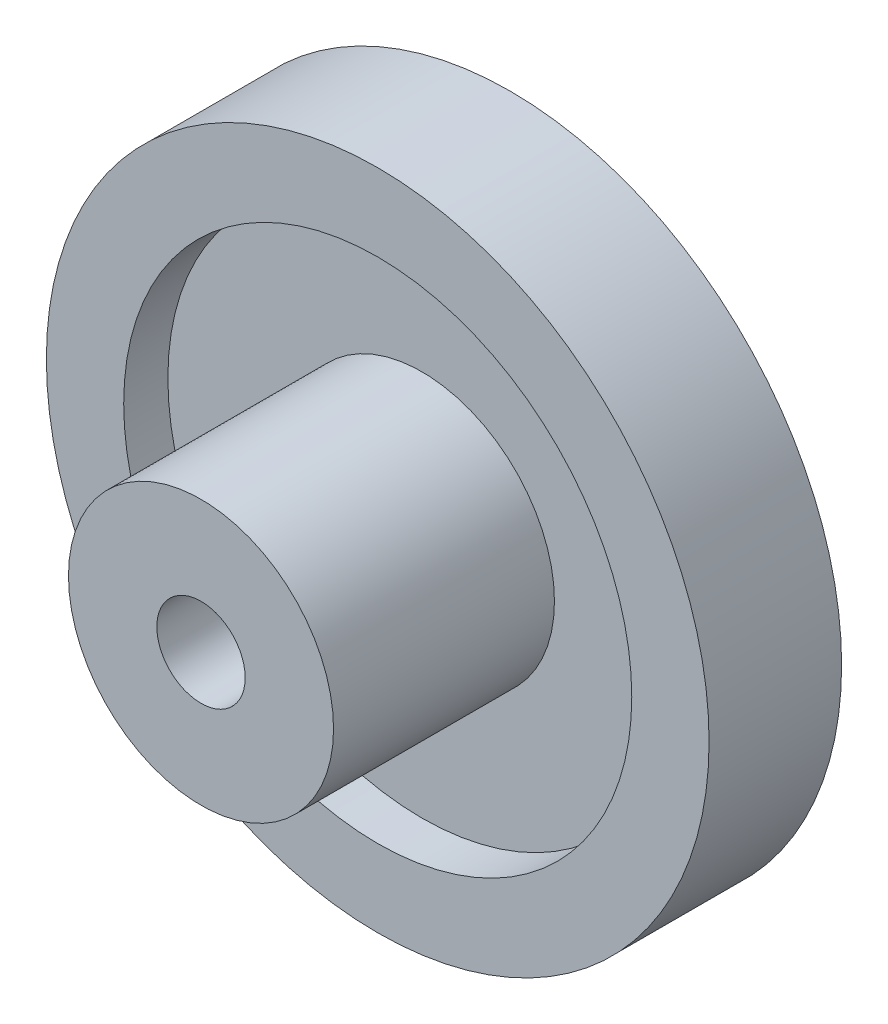
from build123d import *

# Parameters (mm, degrees)
ESQUISSE1_R             = 1
BOSS_EXTRU_1_DEPTH      = 3
ESQUISSE2_R             = 5.75
ENL_V_MAT_EXTRU_1_DEPTH = 1
ESQUISSE3_R             = 1
BOSS_EXTRU_2_DEPTH      = 5
BOSS_EXTRU_3_START      = -3
ESQUISSE4_R             = 7.5
ESQUISSE4_R_2           = 5.75
BOSS_EXTRU_3_DEPTH      = 3
BOSS_EXTRU_4_START      = -5
ESQUISSE5_R             = 3
ESQUISSE5_R_2           = 1
BOSS_EXTRU_4_DEPTH      = 5


with BuildPart() as part:
    # Esquisse1 → Boss.-Extru.1 (new body)
    with BuildSketch(Plane.XY):
        with BuildLine():
            ThreePointArc((7.491868518, 0.349150543), (7.48109955, 0.532117964), (7.465862795, 0.714767599))
            add(Edge.make_bspline(
                [(6.511775734, 0.931053619), (6.54533459, 0.935851864), (6.691230758, 0.932883331), (6.92755526, 0.897904294), (7.210754579, 0.816287714), (7.382633754, 0.750372838), (7.465862795, 0.714767599)],
                knots=[0, 0, 0, 0, 0.101700454, 0.434977009, 0.714423103, 0.984887496, 0.984887496, 0.984887496, 0.984887496], degree=3))
            ThreePointArc((6.511775734, 0.931053619), (6.361956751, 0.966352964), (6.279971624, 1.096622724))
            ThreePointArc((6.279971624, 1.096622724), (6.268309408, 1.161431083), (6.255978398, 1.226115524))
            ThreePointArc((6.255978398, 1.226115524), (6.285849036, 1.377110609), (6.413075806, 1.463742704))
            add(Edge.make_bspline(
                [(6.413075806, 1.463742704), (6.44612601, 1.471286197), (6.581273617, 1.526328257), (6.789378175, 1.643653855), (7.024536913, 1.821315017), (7.161390753, 1.944433854), (7.226338428, 2.00749419)],
                knots=[0, 0, 0, 0, 0.101700454, 0.434977009, 0.714423103, 0.984887496, 0.984887496, 0.984887496, 0.984887496], degree=3))
            ThreePointArc((7.226338428, 2.00749419), (7.175125379, 2.183477914), (7.119627274, 2.358157645))
            add(Edge.make_bspline(
                [(6.141333, 2.356716579), (6.172982756, 2.36886207), (6.315881563, 2.398432916), (6.554064484, 2.416918025), (6.848324803, 2.40036552), (7.030562047, 2.374349982), (7.119627274, 2.358157645)],
                knots=[0, 0, 0, 0, 0.101700454, 0.434977009, 0.714423103, 0.984887496, 0.984887496, 0.984887496, 0.984887496], degree=3))
            ThreePointArc((6.141333, 2.356716579), (5.987415449, 2.357793036), (5.878498112, 2.466553254))
            ThreePointArc((5.878498112, 2.466553254), (5.852707075, 2.527141645), (5.826291587, 2.587460404))
            ThreePointArc((5.826291587, 2.587460404), (5.821813738, 2.741316569), (5.926573213, 2.854087236))
            add(Edge.make_bspline(
                [(5.926573213, 2.854087236), (5.957116194, 2.86879596), (6.076627358, 2.952531173), (6.253406899, 3.113222794), (6.443136388, 3.338757362), (6.549162498, 3.489242196), (6.598449554, 3.565173695)],
                knots=[0, 0, 0, 0, 0.101700454, 0.434977009, 0.714423103, 0.984887496, 0.984887496, 0.984887496, 0.984887496], degree=3))
            ThreePointArc((6.598449554, 3.565173695), (6.50936046, 3.725349165), (6.416383912, 3.88329982))
            add(Edge.make_bspline(
                [(5.462938185, 3.664203929), (5.49109179, 3.683087641), (5.623827693, 3.743715059), (5.851925548, 3.814737394), (6.142491424, 3.864078976), (6.325948603, 3.879267303), (6.416383912, 3.88329982)],
                knots=[0, 0, 0, 0, 0.101700454, 0.434977009, 0.714423103, 0.984887496, 0.984887496, 0.984887496, 0.984887496], degree=3))
            ThreePointArc((5.462938185, 3.664203929), (5.312640134, 3.631003519), (5.182252157, 3.712800504))
            ThreePointArc((5.182252157, 3.712800504), (5.14362557, 3.766130772), (5.104450187, 3.819059215))
            ThreePointArc((5.104450187, 3.819059215), (5.06584839, 3.96806147), (5.142887492, 4.101315917))
            add(Edge.make_bspline(
                [(5.142887492, 4.101315917), (5.169391697, 4.122452315), (5.267273629, 4.230681847), (5.403863688, 4.426681742), (5.5386501, 4.688780471), (5.608531889, 4.859085365), (5.639686867, 4.944080505)],
                knots=[0, 0, 0, 0, 0.101700454, 0.434977009, 0.714423103, 0.984887496, 0.984887496, 0.984887496, 0.984887496], degree=3))
            ThreePointArc((5.639686867, 4.944080505), (5.517189028, 5.080415852), (5.391396269, 5.213717126))
            add(Edge.make_bspline(
                [(4.510608839, 4.787952794), (4.533854553, 4.812627817), (4.64977162, 4.901271697), (4.856346629, 5.021269902), (5.128647877, 5.134031378), (5.30412568, 5.189661964), (5.391396269, 5.213717126)],
                knots=[0, 0, 0, 0, 0.101700454, 0.434977009, 0.714423103, 0.984887496, 0.984887496, 0.984887496, 0.984887496], degree=3))
            ThreePointArc((4.510608839, 4.787952794), (4.37146686, 4.722140325), (4.22614644, 4.772872434))
            ThreePointArc((4.22614644, 4.772872434), (4.176621201, 4.816270376), (4.12665034, 4.85915445))
            ThreePointArc((4.12665034, 4.85915445), (4.05586025, 4.995831199), (4.101315917, 5.142887492))
            add(Edge.make_bspline(
                [(4.101315917, 5.142887492), (4.122452315, 5.169391697), (4.193796806, 5.296688467), (4.283348187, 5.518168384), (4.356432769, 5.803688548), (4.386666071, 5.985273704), (4.398126732, 6.075070473)],
                knots=[0, 0, 0, 0, 0.101700454, 0.434977009, 0.714423103, 0.984887496, 0.984887496, 0.984887496, 0.984887496], degree=3))
            ThreePointArc((4.398126732, 6.075070473), (4.248362699, 6.180729275), (4.096061504, 6.282696886))
            add(Edge.make_bspline(
                [(3.332098731, 5.671613712), (3.349270916, 5.700842739), (3.442556582, 5.813058106), (3.617250211, 5.976014969), (3.85763251, 6.146542008), (4.016331748, 6.239825304), (4.096061504, 6.282696886)],
                knots=[0, 0, 0, 0, 0.101700454, 0.434977009, 0.714423103, 0.984887496, 0.984887496, 0.984887496, 0.984887496], degree=3))
            ThreePointArc((3.332098731, 5.671613712), (3.211089984, 5.576489296), (3.058124094, 5.59361261))
            ThreePointArc((3.058124094, 5.59361261), (3.000183606, 5.624902073), (2.941923014, 5.655591391))
            ThreePointArc((2.941923014, 5.655591391), (2.842494341, 5.773089092), (2.854087236, 5.926573213))
            add(Edge.make_bspline(
                [(2.854087236, 5.926573213), (2.86879596, 5.957116194), (2.9100255, 6.097097011), (2.948047723, 6.33295102), (2.955765708, 6.627575448), (2.9448345, 6.811335427), (2.936026156, 6.901431041)],
                knots=[0, 0, 0, 0, 0.101700454, 0.434977009, 0.714423103, 0.984887496, 0.984887496, 0.984887496, 0.984887496], degree=3))
            ThreePointArc((2.936026156, 6.901431041), (2.766505726, 6.971115124), (2.595333111, 7.036635989))
            add(Edge.make_bspline(
                [(1.986503278, 6.270876237), (1.996740851, 6.303193602), (2.062717382, 6.433353509), (2.196769764, 6.631097693), (2.393179341, 6.850839356), (2.527142172, 6.977097748), (2.595333111, 7.036635989)],
                knots=[0, 0, 0, 0, 0.101700454, 0.434977009, 0.714423103, 0.984887496, 0.984887496, 0.984887496, 0.984887496], degree=3))
            ThreePointArc((1.986503278, 6.270876237), (1.889695647, 6.151209809), (1.736754636, 6.133865693))
            ThreePointArc((1.736754636, 6.133865693), (1.673304276, 6.151477692), (1.609675384, 6.168433363))
            ThreePointArc((1.609675384, 6.168433363), (1.486593897, 6.26086019), (1.463742704, 6.413075806))
            add(Edge.make_bspline(
                [(1.463742704, 6.413075806), (1.471286197, 6.44612601), (1.480333363, 6.591771651), (1.464919836, 6.830173049), (1.406884212, 7.11912804), (1.35533663, 7.295848351), (1.32670097, 7.381725038)],
                knots=[0, 0, 0, 0, 0.101700454, 0.434977009, 0.714423103, 0.984887496, 0.984887496, 0.984887496, 0.984887496], degree=3))
            ThreePointArc((1.32670097, 7.381725038), (1.145924603, 7.411940151), (0.964463879, 7.437728781))
            add(Edge.make_bspline(
                [(0.541296257, 6.555690842), (0.544085862, 6.589476018), (0.57944492, 6.731053703), (0.666134108, 6.953669488), (0.808722167, 7.211607012), (0.911231134, 7.364509376), (0.964463879, 7.437728781)],
                knots=[0, 0, 0, 0, 0.101700454, 0.434977009, 0.714423103, 0.984887496, 0.984887496, 0.984887496, 0.984887496], degree=3))
            ThreePointArc((0.541296257, 6.555690842), (0.47354408, 6.417482977), (0.328297049, 6.366541137))
            ThreePointArc((0.328297049, 6.366541137), (0.262518483, 6.369592534), (0.196711908, 6.37196433))
            ThreePointArc((0.196711908, 6.37196433), (0.056149427, 6.434685616), (0, 6.578))
            add(Edge.make_bspline(
                [(0, 6.578), (0, 6.611900151), (-0.023588869, 6.755907336), (-0.091665249, 6.984901681), (-0.212544333, 7.253697825), (-0.302123478, 7.414516973), (-0.349150543, 7.491868518)],
                knots=[0, 0, 0, 0, 0.101700454, 0.434977009, 0.714423103, 0.984887496, 0.984887496, 0.984887496, 0.984887496], degree=3))
            ThreePointArc((-0.349150543, 7.491868518), (-0.532117964, 7.48109955), (-0.714767599, 7.465862795))
            add(Edge.make_bspline(
                [(-0.931053619, 6.511775734), (-0.935851864, 6.54533459), (-0.932883331, 6.691230758), (-0.897904294, 6.92755526), (-0.816287714, 7.210754579), (-0.750372838, 7.382633754), (-0.714767599, 7.465862795)],
                knots=[0, 0, 0, 0, 0.101700454, 0.434977009, 0.714423103, 0.984887496, 0.984887496, 0.984887496, 0.984887496], degree=3))
            ThreePointArc((-0.931053619, 6.511775734), (-0.966352964, 6.361956751), (-1.096622724, 6.279971624))
            ThreePointArc((-1.096622724, 6.279971624), (-1.161431083, 6.268309408), (-1.226115524, 6.255978398))
            ThreePointArc((-1.226115524, 6.255978398), (-1.377110609, 6.285849036), (-1.463742704, 6.413075806))
            add(Edge.make_bspline(
                [(-1.463742704, 6.413075806), (-1.471286197, 6.44612601), (-1.526328257, 6.581273617), (-1.643653855, 6.789378175), (-1.821315017, 7.024536913), (-1.944433854, 7.161390753), (-2.00749419, 7.226338428)],
                knots=[0, 0, 0, 0, 0.101700454, 0.434977009, 0.714423103, 0.984887496, 0.984887496, 0.984887496, 0.984887496], degree=3))
            ThreePointArc((-2.00749419, 7.226338428), (-2.183477914, 7.175125379), (-2.358157645, 7.119627274))
            add(Edge.make_bspline(
                [(-2.356716579, 6.141333), (-2.36886207, 6.172982756), (-2.398432916, 6.315881563), (-2.416918025, 6.554064484), (-2.40036552, 6.848324803), (-2.374349982, 7.030562047), (-2.358157645, 7.119627274)],
                knots=[0, 0, 0, 0, 0.101700454, 0.434977009, 0.714423103, 0.984887496, 0.984887496, 0.984887496, 0.984887496], degree=3))
            ThreePointArc((-2.356716579, 6.141333), (-2.357793036, 5.987415449), (-2.466553254, 5.878498112))
            ThreePointArc((-2.466553254, 5.878498112), (-2.527141645, 5.852707075), (-2.587460404, 5.826291587))
            ThreePointArc((-2.587460404, 5.826291587), (-2.741316569, 5.821813738), (-2.854087236, 5.926573213))
            add(Edge.make_bspline(
                [(-2.854087236, 5.926573213), (-2.86879596, 5.957116194), (-2.952531173, 6.076627358), (-3.113222794, 6.253406899), (-3.338757362, 6.443136388), (-3.489242196, 6.549162498), (-3.565173695, 6.598449554)],
                knots=[0, 0, 0, 0, 0.101700454, 0.434977009, 0.714423103, 0.984887496, 0.984887496, 0.984887496, 0.984887496], degree=3))
            ThreePointArc((-3.565173695, 6.598449554), (-3.725349165, 6.50936046), (-3.88329982, 6.416383912))
            add(Edge.make_bspline(
                [(-3.664203929, 5.462938185), (-3.683087641, 5.49109179), (-3.743715059, 5.623827693), (-3.814737394, 5.851925548), (-3.864078976, 6.142491424), (-3.879267303, 6.325948603), (-3.88329982, 6.416383912)],
                knots=[0, 0, 0, 0, 0.101700454, 0.434977009, 0.714423103, 0.984887496, 0.984887496, 0.984887496, 0.984887496], degree=3))
            ThreePointArc((-3.664203929, 5.462938185), (-3.631003519, 5.312640134), (-3.712800504, 5.182252157))
            ThreePointArc((-3.712800504, 5.182252157), (-3.766130772, 5.14362557), (-3.819059215, 5.104450187))
            ThreePointArc((-3.819059215, 5.104450187), (-3.96806147, 5.06584839), (-4.101315917, 5.142887492))
            add(Edge.make_bspline(
                [(-4.101315917, 5.142887492), (-4.122452315, 5.169391697), (-4.230681847, 5.267273629), (-4.426681742, 5.403863688), (-4.688780471, 5.5386501), (-4.859085365, 5.608531889), (-4.944080505, 5.639686867)],
                knots=[0, 0, 0, 0, 0.101700454, 0.434977009, 0.714423103, 0.984887496, 0.984887496, 0.984887496, 0.984887496], degree=3))
            ThreePointArc((-4.944080505, 5.639686867), (-5.080415852, 5.517189028), (-5.213717126, 5.391396269))
            add(Edge.make_bspline(
                [(-4.787952794, 4.510608839), (-4.812627817, 4.533854553), (-4.901271697, 4.64977162), (-5.021269902, 4.856346629), (-5.134031378, 5.128647877), (-5.189661964, 5.30412568), (-5.213717126, 5.391396269)],
                knots=[0, 0, 0, 0, 0.101700454, 0.434977009, 0.714423103, 0.984887496, 0.984887496, 0.984887496, 0.984887496], degree=3))
            ThreePointArc((-4.787952794, 4.510608839), (-4.722140325, 4.37146686), (-4.772872434, 4.22614644))
            ThreePointArc((-4.772872434, 4.22614644), (-4.816270376, 4.176621201), (-4.85915445, 4.12665034))
            ThreePointArc((-4.85915445, 4.12665034), (-4.995831199, 4.05586025), (-5.142887492, 4.101315917))
            add(Edge.make_bspline(
                [(-5.142887492, 4.101315917), (-5.169391697, 4.122452315), (-5.296688467, 4.193796806), (-5.518168384, 4.283348187), (-5.803688548, 4.356432769), (-5.985273704, 4.386666071), (-6.075070473, 4.398126732)],
                knots=[0, 0, 0, 0, 0.101700454, 0.434977009, 0.714423103, 0.984887496, 0.984887496, 0.984887496, 0.984887496], degree=3))
            ThreePointArc((-6.075070473, 4.398126732), (-6.180729275, 4.248362699), (-6.282696886, 4.096061504))
            add(Edge.make_bspline(
                [(-5.671613712, 3.332098731), (-5.700842739, 3.349270916), (-5.813058106, 3.442556582), (-5.976014969, 3.617250211), (-6.146542008, 3.85763251), (-6.239825304, 4.016331748), (-6.282696886, 4.096061504)],
                knots=[0, 0, 0, 0, 0.101700454, 0.434977009, 0.714423103, 0.984887496, 0.984887496, 0.984887496, 0.984887496], degree=3))
            ThreePointArc((-5.671613712, 3.332098731), (-5.576489296, 3.211089984), (-5.59361261, 3.058124094))
            ThreePointArc((-5.59361261, 3.058124094), (-5.624902073, 3.000183606), (-5.655591391, 2.941923014))
            ThreePointArc((-5.655591391, 2.941923014), (-5.773089092, 2.842494341), (-5.926573213, 2.854087236))
            add(Edge.make_bspline(
                [(-5.926573213, 2.854087236), (-5.957116194, 2.86879596), (-6.097097011, 2.9100255), (-6.33295102, 2.948047723), (-6.627575448, 2.955765708), (-6.811335427, 2.9448345), (-6.901431041, 2.936026156)],
                knots=[0, 0, 0, 0, 0.101700454, 0.434977009, 0.714423103, 0.984887496, 0.984887496, 0.984887496, 0.984887496], degree=3))
            ThreePointArc((-6.901431041, 2.936026156), (-6.971115124, 2.766505726), (-7.036635989, 2.595333111))
            add(Edge.make_bspline(
                [(-6.270876237, 1.986503278), (-6.303193602, 1.996740851), (-6.433353509, 2.062717382), (-6.631097693, 2.196769764), (-6.850839356, 2.393179341), (-6.977097748, 2.527142172), (-7.036635989, 2.595333111)],
                knots=[0, 0, 0, 0, 0.101700454, 0.434977009, 0.714423103, 0.984887496, 0.984887496, 0.984887496, 0.984887496], degree=3))
            ThreePointArc((-6.270876237, 1.986503278), (-6.151209809, 1.889695647), (-6.133865693, 1.736754636))
            ThreePointArc((-6.133865693, 1.736754636), (-6.151477692, 1.673304276), (-6.168433363, 1.609675384))
            ThreePointArc((-6.168433363, 1.609675384), (-6.26086019, 1.486593897), (-6.413075806, 1.463742704))
            add(Edge.make_bspline(
                [(-6.413075806, 1.463742704), (-6.44612601, 1.471286197), (-6.591771651, 1.480333363), (-6.830173049, 1.464919836), (-7.11912804, 1.406884212), (-7.295848351, 1.35533663), (-7.381725038, 1.32670097)],
                knots=[0, 0, 0, 0, 0.101700454, 0.434977009, 0.714423103, 0.984887496, 0.984887496, 0.984887496, 0.984887496], degree=3))
            ThreePointArc((-7.381725038, 1.32670097), (-7.411940151, 1.145924603), (-7.437728781, 0.964463879))
            add(Edge.make_bspline(
                [(-6.555690842, 0.541296257), (-6.589476018, 0.544085862), (-6.731053703, 0.57944492), (-6.953669488, 0.666134108), (-7.211607012, 0.808722167), (-7.364509376, 0.911231134), (-7.437728781, 0.964463879)],
                knots=[0, 0, 0, 0, 0.101700454, 0.434977009, 0.714423103, 0.984887496, 0.984887496, 0.984887496, 0.984887496], degree=3))
            ThreePointArc((-6.555690842, 0.541296257), (-6.417482977, 0.47354408), (-6.366541137, 0.328297049))
            ThreePointArc((-6.366541137, 0.328297049), (-6.369592534, 0.262518483), (-6.37196433, 0.196711908))
            ThreePointArc((-6.37196433, 0.196711908), (-6.434685616, 0.056149427), (-6.578, 0))
            add(Edge.make_bspline(
                [(-6.578, 0), (-6.611900151, 0), (-6.755907336, -0.023588869), (-6.984901681, -0.091665249), (-7.253697825, -0.212544333), (-7.414516973, -0.302123478), (-7.491868518, -0.349150543)],
                knots=[0, 0, 0, 0, 0.101700454, 0.434977009, 0.714423103, 0.984887496, 0.984887496, 0.984887496, 0.984887496], degree=3))
            ThreePointArc((-7.491868518, -0.349150543), (-7.48109955, -0.532117964), (-7.465862795, -0.714767599))
            add(Edge.make_bspline(
                [(-6.511775734, -0.931053619), (-6.54533459, -0.935851864), (-6.691230758, -0.932883331), (-6.92755526, -0.897904294), (-7.210754579, -0.816287714), (-7.382633754, -0.750372838), (-7.465862795, -0.714767599)],
                knots=[0, 0, 0, 0, 0.101700454, 0.434977009, 0.714423103, 0.984887496, 0.984887496, 0.984887496, 0.984887496], degree=3))
            ThreePointArc((-6.511775734, -0.931053619), (-6.361956751, -0.966352964), (-6.279971624, -1.096622724))
            ThreePointArc((-6.279971624, -1.096622724), (-6.268309408, -1.161431083), (-6.255978398, -1.226115524))
            ThreePointArc((-6.255978398, -1.226115524), (-6.285849036, -1.377110609), (-6.413075806, -1.463742704))
            add(Edge.make_bspline(
                [(-6.413075806, -1.463742704), (-6.44612601, -1.471286197), (-6.581273617, -1.526328257), (-6.789378175, -1.643653855), (-7.024536913, -1.821315017), (-7.161390753, -1.944433854), (-7.226338428, -2.00749419)],
                knots=[0, 0, 0, 0, 0.101700454, 0.434977009, 0.714423103, 0.984887496, 0.984887496, 0.984887496, 0.984887496], degree=3))
            ThreePointArc((-7.226338428, -2.00749419), (-7.175125379, -2.183477914), (-7.119627274, -2.358157645))
            add(Edge.make_bspline(
                [(-6.141333, -2.356716579), (-6.172982756, -2.36886207), (-6.315881563, -2.398432916), (-6.554064484, -2.416918025), (-6.848324803, -2.40036552), (-7.030562047, -2.374349982), (-7.119627274, -2.358157645)],
                knots=[0, 0, 0, 0, 0.101700454, 0.434977009, 0.714423103, 0.984887496, 0.984887496, 0.984887496, 0.984887496], degree=3))
            ThreePointArc((-6.141333, -2.356716579), (-5.987415449, -2.357793036), (-5.878498112, -2.466553254))
            ThreePointArc((-5.878498112, -2.466553254), (-5.852707075, -2.527141645), (-5.826291587, -2.587460404))
            ThreePointArc((-5.826291587, -2.587460404), (-5.821813738, -2.741316569), (-5.926573213, -2.854087236))
            add(Edge.make_bspline(
                [(-5.926573213, -2.854087236), (-5.957116194, -2.86879596), (-6.076627358, -2.952531173), (-6.253406899, -3.113222794), (-6.443136388, -3.338757362), (-6.549162498, -3.489242196), (-6.598449554, -3.565173695)],
                knots=[0, 0, 0, 0, 0.101700454, 0.434977009, 0.714423103, 0.984887496, 0.984887496, 0.984887496, 0.984887496], degree=3))
            ThreePointArc((-6.598449554, -3.565173695), (-6.50936046, -3.725349165), (-6.416383912, -3.88329982))
            add(Edge.make_bspline(
                [(-5.462938185, -3.664203929), (-5.49109179, -3.683087641), (-5.623827693, -3.743715059), (-5.851925548, -3.814737394), (-6.142491424, -3.864078976), (-6.325948603, -3.879267303), (-6.416383912, -3.88329982)],
                knots=[0, 0, 0, 0, 0.101700454, 0.434977009, 0.714423103, 0.984887496, 0.984887496, 0.984887496, 0.984887496], degree=3))
            ThreePointArc((-5.462938185, -3.664203929), (-5.312640134, -3.631003519), (-5.182252157, -3.712800504))
            ThreePointArc((-5.182252157, -3.712800504), (-5.14362557, -3.766130772), (-5.104450187, -3.819059215))
            ThreePointArc((-5.104450187, -3.819059215), (-5.06584839, -3.96806147), (-5.142887492, -4.101315917))
            add(Edge.make_bspline(
                [(-5.142887492, -4.101315917), (-5.169391697, -4.122452315), (-5.267273629, -4.230681847), (-5.403863688, -4.426681742), (-5.5386501, -4.688780471), (-5.608531889, -4.859085365), (-5.639686867, -4.944080505)],
                knots=[0, 0, 0, 0, 0.101700454, 0.434977009, 0.714423103, 0.984887496, 0.984887496, 0.984887496, 0.984887496], degree=3))
            ThreePointArc((-5.639686867, -4.944080505), (-5.517189028, -5.080415852), (-5.391396269, -5.213717126))
            add(Edge.make_bspline(
                [(-4.510608839, -4.787952794), (-4.533854553, -4.812627817), (-4.64977162, -4.901271697), (-4.856346629, -5.021269902), (-5.128647877, -5.134031378), (-5.30412568, -5.189661964), (-5.391396269, -5.213717126)],
                knots=[0, 0, 0, 0, 0.101700454, 0.434977009, 0.714423103, 0.984887496, 0.984887496, 0.984887496, 0.984887496], degree=3))
            ThreePointArc((-4.510608839, -4.787952794), (-4.37146686, -4.722140325), (-4.22614644, -4.772872434))
            ThreePointArc((-4.22614644, -4.772872434), (-4.176621201, -4.816270376), (-4.12665034, -4.85915445))
            ThreePointArc((-4.12665034, -4.85915445), (-4.05586025, -4.995831199), (-4.101315917, -5.142887492))
            add(Edge.make_bspline(
                [(-4.101315917, -5.142887492), (-4.122452315, -5.169391697), (-4.193796806, -5.296688467), (-4.283348187, -5.518168384), (-4.356432769, -5.803688548), (-4.386666071, -5.985273704), (-4.398126732, -6.075070473)],
                knots=[0, 0, 0, 0, 0.101700454, 0.434977009, 0.714423103, 0.984887496, 0.984887496, 0.984887496, 0.984887496], degree=3))
            ThreePointArc((-4.398126732, -6.075070473), (-4.248362699, -6.180729275), (-4.096061504, -6.282696886))
            add(Edge.make_bspline(
                [(-3.332098731, -5.671613712), (-3.349270916, -5.700842739), (-3.442556582, -5.813058106), (-3.617250211, -5.976014969), (-3.85763251, -6.146542008), (-4.016331748, -6.239825304), (-4.096061504, -6.282696886)],
                knots=[0, 0, 0, 0, 0.101700454, 0.434977009, 0.714423103, 0.984887496, 0.984887496, 0.984887496, 0.984887496], degree=3))
            ThreePointArc((-3.332098731, -5.671613712), (-3.211089984, -5.576489296), (-3.058124094, -5.59361261))
            ThreePointArc((-3.058124094, -5.59361261), (-3.000183606, -5.624902073), (-2.941923014, -5.655591391))
            ThreePointArc((-2.941923014, -5.655591391), (-2.842494341, -5.773089092), (-2.854087236, -5.926573213))
            add(Edge.make_bspline(
                [(-2.854087236, -5.926573213), (-2.86879596, -5.957116194), (-2.9100255, -6.097097011), (-2.948047723, -6.33295102), (-2.955765708, -6.627575448), (-2.9448345, -6.811335427), (-2.936026156, -6.901431041)],
                knots=[0, 0, 0, 0, 0.101700454, 0.434977009, 0.714423103, 0.984887496, 0.984887496, 0.984887496, 0.984887496], degree=3))
            ThreePointArc((-2.936026156, -6.901431041), (-2.766505726, -6.971115124), (-2.595333111, -7.036635989))
            add(Edge.make_bspline(
                [(-1.986503278, -6.270876237), (-1.996740851, -6.303193602), (-2.062717382, -6.433353509), (-2.196769764, -6.631097693), (-2.393179341, -6.850839356), (-2.527142172, -6.977097748), (-2.595333111, -7.036635989)],
                knots=[0, 0, 0, 0, 0.101700454, 0.434977009, 0.714423103, 0.984887496, 0.984887496, 0.984887496, 0.984887496], degree=3))
            ThreePointArc((-1.986503278, -6.270876237), (-1.889695647, -6.151209809), (-1.736754636, -6.133865693))
            ThreePointArc((-1.736754636, -6.133865693), (-1.673304276, -6.151477692), (-1.609675384, -6.168433363))
            ThreePointArc((-1.609675384, -6.168433363), (-1.486593897, -6.26086019), (-1.463742704, -6.413075806))
            add(Edge.make_bspline(
                [(-1.463742704, -6.413075806), (-1.471286197, -6.44612601), (-1.480333363, -6.591771651), (-1.464919836, -6.830173049), (-1.406884212, -7.11912804), (-1.35533663, -7.295848351), (-1.32670097, -7.381725038)],
                knots=[0, 0, 0, 0, 0.101700454, 0.434977009, 0.714423103, 0.984887496, 0.984887496, 0.984887496, 0.984887496], degree=3))
            ThreePointArc((-1.32670097, -7.381725038), (-1.145924603, -7.411940151), (-0.964463879, -7.437728781))
            add(Edge.make_bspline(
                [(-0.541296257, -6.555690842), (-0.544085862, -6.589476018), (-0.57944492, -6.731053703), (-0.666134108, -6.953669488), (-0.808722167, -7.211607012), (-0.911231134, -7.364509376), (-0.964463879, -7.437728781)],
                knots=[0, 0, 0, 0, 0.101700454, 0.434977009, 0.714423103, 0.984887496, 0.984887496, 0.984887496, 0.984887496], degree=3))
            ThreePointArc((-0.541296257, -6.555690842), (-0.47354408, -6.417482977), (-0.328297049, -6.366541137))
            ThreePointArc((-0.328297049, -6.366541137), (-0.262518483, -6.369592534), (-0.196711908, -6.37196433))
            ThreePointArc((-0.196711908, -6.37196433), (-0.056149427, -6.434685616), (0, -6.578))
            add(Edge.make_bspline(
                [(0, -6.578), (0, -6.611900151), (0.023588869, -6.755907336), (0.091665249, -6.984901681), (0.212544333, -7.253697825), (0.302123478, -7.414516973), (0.349150543, -7.491868518)],
                knots=[0, 0, 0, 0, 0.101700454, 0.434977009, 0.714423103, 0.984887496, 0.984887496, 0.984887496, 0.984887496], degree=3))
            ThreePointArc((0.349150543, -7.491868518), (0.532117964, -7.48109955), (0.714767599, -7.465862795))
            add(Edge.make_bspline(
                [(0.931053619, -6.511775734), (0.935851864, -6.54533459), (0.932883331, -6.691230758), (0.897904294, -6.92755526), (0.816287714, -7.210754579), (0.750372838, -7.382633754), (0.714767599, -7.465862795)],
                knots=[0, 0, 0, 0, 0.101700454, 0.434977009, 0.714423103, 0.984887496, 0.984887496, 0.984887496, 0.984887496], degree=3))
            ThreePointArc((0.931053619, -6.511775734), (0.966352964, -6.361956751), (1.096622724, -6.279971624))
            ThreePointArc((1.096622724, -6.279971624), (1.161431083, -6.268309408), (1.226115524, -6.255978398))
            ThreePointArc((1.226115524, -6.255978398), (1.377110609, -6.285849036), (1.463742704, -6.413075806))
            add(Edge.make_bspline(
                [(1.463742704, -6.413075806), (1.471286197, -6.44612601), (1.526328257, -6.581273617), (1.643653855, -6.789378175), (1.821315017, -7.024536913), (1.944433854, -7.161390753), (2.00749419, -7.226338428)],
                knots=[0, 0, 0, 0, 0.101700454, 0.434977009, 0.714423103, 0.984887496, 0.984887496, 0.984887496, 0.984887496], degree=3))
            ThreePointArc((2.00749419, -7.226338428), (2.183477914, -7.175125379), (2.358157645, -7.119627274))
            add(Edge.make_bspline(
                [(2.356716579, -6.141333), (2.36886207, -6.172982756), (2.398432916, -6.315881563), (2.416918025, -6.554064484), (2.40036552, -6.848324803), (2.374349982, -7.030562047), (2.358157645, -7.119627274)],
                knots=[0, 0, 0, 0, 0.101700454, 0.434977009, 0.714423103, 0.984887496, 0.984887496, 0.984887496, 0.984887496], degree=3))
            ThreePointArc((2.356716579, -6.141333), (2.357793036, -5.987415449), (2.466553254, -5.878498112))
            ThreePointArc((2.466553254, -5.878498112), (2.527141645, -5.852707075), (2.587460404, -5.826291587))
            ThreePointArc((2.587460404, -5.826291587), (2.741316569, -5.821813738), (2.854087236, -5.926573213))
            add(Edge.make_bspline(
                [(2.854087236, -5.926573213), (2.86879596, -5.957116194), (2.952531173, -6.076627358), (3.113222794, -6.253406899), (3.338757362, -6.443136388), (3.489242196, -6.549162498), (3.565173695, -6.598449554)],
                knots=[0, 0, 0, 0, 0.101700454, 0.434977009, 0.714423103, 0.984887496, 0.984887496, 0.984887496, 0.984887496], degree=3))
            ThreePointArc((3.565173695, -6.598449554), (3.725349165, -6.50936046), (3.88329982, -6.416383912))
            add(Edge.make_bspline(
                [(3.664203929, -5.462938185), (3.683087641, -5.49109179), (3.743715059, -5.623827693), (3.814737394, -5.851925548), (3.864078976, -6.142491424), (3.879267303, -6.325948603), (3.88329982, -6.416383912)],
                knots=[0, 0, 0, 0, 0.101700454, 0.434977009, 0.714423103, 0.984887496, 0.984887496, 0.984887496, 0.984887496], degree=3))
            ThreePointArc((3.664203929, -5.462938185), (3.631003519, -5.312640134), (3.712800504, -5.182252157))
            ThreePointArc((3.712800504, -5.182252157), (3.766130772, -5.14362557), (3.819059215, -5.104450187))
            ThreePointArc((3.819059215, -5.104450187), (3.96806147, -5.06584839), (4.101315917, -5.142887492))
            add(Edge.make_bspline(
                [(4.101315917, -5.142887492), (4.122452315, -5.169391697), (4.230681847, -5.267273629), (4.426681742, -5.403863688), (4.688780471, -5.5386501), (4.859085365, -5.608531889), (4.944080505, -5.639686867)],
                knots=[0, 0, 0, 0, 0.101700454, 0.434977009, 0.714423103, 0.984887496, 0.984887496, 0.984887496, 0.984887496], degree=3))
            ThreePointArc((4.944080505, -5.639686867), (5.080415852, -5.517189028), (5.213717126, -5.391396269))
            add(Edge.make_bspline(
                [(4.787952794, -4.510608839), (4.812627817, -4.533854553), (4.901271697, -4.64977162), (5.021269902, -4.856346629), (5.134031378, -5.128647877), (5.189661964, -5.30412568), (5.213717126, -5.391396269)],
                knots=[0, 0, 0, 0, 0.101700454, 0.434977009, 0.714423103, 0.984887496, 0.984887496, 0.984887496, 0.984887496], degree=3))
            ThreePointArc((4.787952794, -4.510608839), (4.722140325, -4.37146686), (4.772872434, -4.22614644))
            ThreePointArc((4.772872434, -4.22614644), (4.816270376, -4.176621201), (4.85915445, -4.12665034))
            ThreePointArc((4.85915445, -4.12665034), (4.995831199, -4.05586025), (5.142887492, -4.101315917))
            add(Edge.make_bspline(
                [(5.142887492, -4.101315917), (5.169391697, -4.122452315), (5.296688467, -4.193796806), (5.518168384, -4.283348187), (5.803688548, -4.356432769), (5.985273704, -4.386666071), (6.075070473, -4.398126732)],
                knots=[0, 0, 0, 0, 0.101700454, 0.434977009, 0.714423103, 0.984887496, 0.984887496, 0.984887496, 0.984887496], degree=3))
            ThreePointArc((6.075070473, -4.398126732), (6.180729275, -4.248362699), (6.282696886, -4.096061504))
            add(Edge.make_bspline(
                [(5.671613712, -3.332098731), (5.700842739, -3.349270916), (5.813058106, -3.442556582), (5.976014969, -3.617250211), (6.146542008, -3.85763251), (6.239825304, -4.016331748), (6.282696886, -4.096061504)],
                knots=[0, 0, 0, 0, 0.101700454, 0.434977009, 0.714423103, 0.984887496, 0.984887496, 0.984887496, 0.984887496], degree=3))
            ThreePointArc((5.671613712, -3.332098731), (5.576489296, -3.211089984), (5.59361261, -3.058124094))
            ThreePointArc((5.59361261, -3.058124094), (5.624902073, -3.000183606), (5.655591391, -2.941923014))
            ThreePointArc((5.655591391, -2.941923014), (5.773089092, -2.842494341), (5.926573213, -2.854087236))
            add(Edge.make_bspline(
                [(5.926573213, -2.854087236), (5.957116194, -2.86879596), (6.097097011, -2.9100255), (6.33295102, -2.948047723), (6.627575448, -2.955765708), (6.811335427, -2.9448345), (6.901431041, -2.936026156)],
                knots=[0, 0, 0, 0, 0.101700454, 0.434977009, 0.714423103, 0.984887496, 0.984887496, 0.984887496, 0.984887496], degree=3))
            ThreePointArc((6.901431041, -2.936026156), (6.971115124, -2.766505726), (7.036635989, -2.595333111))
            add(Edge.make_bspline(
                [(6.270876237, -1.986503278), (6.303193602, -1.996740851), (6.433353509, -2.062717382), (6.631097693, -2.196769764), (6.850839356, -2.393179341), (6.977097748, -2.527142172), (7.036635989, -2.595333111)],
                knots=[0, 0, 0, 0, 0.101700454, 0.434977009, 0.714423103, 0.984887496, 0.984887496, 0.984887496, 0.984887496], degree=3))
            ThreePointArc((6.270876237, -1.986503278), (6.151209809, -1.889695647), (6.133865693, -1.736754636))
            ThreePointArc((6.133865693, -1.736754636), (6.151477692, -1.673304276), (6.168433363, -1.609675384))
            ThreePointArc((6.168433363, -1.609675384), (6.26086019, -1.486593897), (6.413075806, -1.463742704))
            add(Edge.make_bspline(
                [(6.413075806, -1.463742704), (6.44612601, -1.471286197), (6.591771651, -1.480333363), (6.830173049, -1.464919836), (7.11912804, -1.406884212), (7.295848351, -1.35533663), (7.381725038, -1.32670097)],
                knots=[0, 0, 0, 0, 0.101700454, 0.434977009, 0.714423103, 0.984887496, 0.984887496, 0.984887496, 0.984887496], degree=3))
            ThreePointArc((7.381725038, -1.32670097), (7.411940151, -1.145924603), (7.437728781, -0.964463879))
            add(Edge.make_bspline(
                [(6.555690842, -0.541296257), (6.589476018, -0.544085862), (6.731053703, -0.57944492), (6.953669488, -0.666134108), (7.211607012, -0.808722167), (7.364509376, -0.911231134), (7.437728781, -0.964463879)],
                knots=[0, 0, 0, 0, 0.101700454, 0.434977009, 0.714423103, 0.984887496, 0.984887496, 0.984887496, 0.984887496], degree=3))
            ThreePointArc((6.555690842, -0.541296257), (6.417482977, -0.47354408), (6.366541137, -0.328297049))
            ThreePointArc((6.366541137, -0.328297049), (6.369592534, -0.262518483), (6.37196433, -0.196711908))
            ThreePointArc((6.37196433, -0.196711908), (6.434685616, -0.056149427), (6.578, 0))
            add(Edge.make_bspline(
                [(6.578, 0), (6.611900151, 0), (6.755907336, 0.023588869), (6.984901681, 0.091665249), (7.253697825, 0.212544333), (7.414516973, 0.302123478), (7.491868518, 0.349150543)],
                knots=[0, 0, 0, 0, 0.101700454, 0.434977009, 0.714423103, 0.984887496, 0.984887496, 0.984887496, 0.984887496], degree=3))
        make_face()
        Circle(ESQUISSE1_R, mode=Mode.SUBTRACT)
    extrude(amount=BOSS_EXTRU_1_DEPTH)

    # Esquisse2 → Enlèv. mat.-Extru.1 (cut)
    with BuildSketch(Plane.XY.offset(3)):
        Circle(ESQUISSE2_R)
    extrude(amount=-ENL_V_MAT_EXTRU_1_DEPTH, mode=Mode.SUBTRACT)

    # Esquisse3 → Boss.-Extru.2 (add)
    with BuildSketch(Plane.XY.offset(2)):
        with BuildLine():
            ThreePointArc((2.977310095, 0.368272455), (2.955741127, 0.513414445), (2.927100903, 0.657328154))
            add(Edge.make_bspline(
                [(2.211403727, 0.79214554), (2.222779445, 0.796220429), (2.274133198, 0.805614359), (2.359373738, 0.810478726), (2.538607422, 0.796225963), (2.732062921, 0.744216047), (2.878239296, 0.681280138), (2.927100903, 0.657328154)],
                knots=[0, 0, 0, 0, 0.036250587, 0.155621312, 0.255291203, 0.575254513, 0.744084786, 0.744084786, 0.744084786, 0.744084786], degree=3))
            add(Edge.make_bspline(
                [(2.211403727, 0.79214554), (2.132130324, 0.763749064), (1.99001212, 0.681956821), (1.750090704, 0.694113528), (1.707279056, 0.775127876)],
                knots=[0, 0, 0, 0, 0.252617676, 0.527509393, 0.527509393, 0.527509393, 0.527509393], degree=3))
            ThreePointArc((1.707279056, 0.775127876), (1.657764419, 0.876037746), (1.602292085, 0.973799299))
            add(Edge.make_bspline(
                [(1.90038092, 1.380707558), (1.832256922, 1.331212576), (1.684611138, 1.259880414), (1.559480437, 1.054813647), (1.602292085, 0.973799299)],
                knots=[0, 0, 0, 0, 0.252617676, 0.527509393, 0.527509393, 0.527509393, 0.527509393], degree=3))
            add(Edge.make_bspline(
                [(1.90038092, 1.380707558), (1.9101567, 1.387810078), (1.946851003, 1.424944725), (1.998895263, 1.49262786), (2.088102134, 1.648736761), (2.154127637, 1.837868182), (2.184488772, 1.994094501), (2.192229346, 2.04795764)],
                knots=[0, 0, 0, 0, 0.036250587, 0.155621312, 0.255291203, 0.575254513, 0.744084786, 0.744084786, 0.744084786, 0.744084786], degree=3))
            ThreePointArc((2.192229346, 2.04795764), (2.089467363, 2.152702055), (1.98170658, 2.25229639))
            add(Edge.make_bspline(
                [(1.32345173, 1.940689701), (1.33025972, 1.950672835), (1.366284165, 1.988457663), (1.432386008, 2.04249615), (1.585766668, 2.136316339), (1.772846116, 2.207949723), (1.928098087, 2.242953821), (1.98170658, 2.25229639)],
                knots=[0, 0, 0, 0, 0.036250587, 0.155621312, 0.255291203, 0.575254513, 0.744084786, 0.744084786, 0.744084786, 0.744084786], degree=3))
            add(Edge.make_bspline(
                [(1.32345173, 1.940689701), (1.27600923, 1.871120733), (1.209109462, 1.721414433), (1.007863426, 1.590227146), (0.925609036, 1.630605075)],
                knots=[0, 0, 0, 0, 0.252617676, 0.527509393, 0.527509393, 0.527509393, 0.527509393], degree=3))
            ThreePointArc((0.925609036, 1.630605075), (0.82623752, 1.683138901), (0.72389666, 1.729623839))
            add(Edge.make_bspline(
                [(0.72588092, 2.234031757), (0.699859868, 2.153947194), (0.622339913, 2.009454248), (0.641642271, 1.770001768), (0.72389666, 1.729623839)],
                knots=[0, 0, 0, 0, 0.252617676, 0.527509393, 0.527509393, 0.527509393, 0.527509393], degree=3))
            add(Edge.make_bspline(
                [(0.72588092, 2.234031757), (0.729614936, 2.245523876), (0.737474053, 2.297134806), (0.739795594, 2.382482461), (0.720206959, 2.561211698), (0.662454053, 2.753031049), (0.595189201, 2.897266624), (0.569791499, 2.945392614)],
                knots=[0, 0, 0, 0, 0.036250587, 0.155621312, 0.255291203, 0.575254513, 0.744084786, 0.744084786, 0.744084786, 0.744084786], degree=3))
            ThreePointArc((0.569791499, 2.945392614), (0.425088085, 2.969730648), (0.279367699, 2.986963958))
            add(Edge.make_bspline(
                [(-0.070013845, 2.347956359), (-0.070374004, 2.360034519), (-0.063438981, 2.411777724), (-0.041724492, 2.494349468), (0.027216945, 2.660406485), (0.136462351, 2.82832165), (0.241488941, 2.947895379), (0.279367699, 2.986963958)],
                knots=[0, 0, 0, 0, 0.036250587, 0.155621312, 0.255291203, 0.575254513, 0.744084786, 0.744084786, 0.744084786, 0.744084786], degree=3))
            add(Edge.make_bspline(
                [(-0.070013845, 2.347956359), (-0.06750402, 2.263787878), (-0.033631914, 2.103350241), (-0.119333425, 1.878928045), (-0.209612175, 1.863246558)],
                knots=[0, 0, 0, 0, 0.252617676, 0.527509393, 0.527509393, 0.527509393, 0.527509393], degree=3))
            ThreePointArc((-0.209612175, 1.863246558), (-0.320884028, 1.847338204), (-0.431002684, 1.824790861))
            add(Edge.make_bspline(
                [(-0.72588092, 2.234031757), (-0.699859868, 2.153947194), (-0.677644007, 1.991484859), (-0.521281435, 1.809109374), (-0.431002684, 1.824790861)],
                knots=[0, 0, 0, 0, 0.252617676, 0.527509393, 0.527509393, 0.527509393, 0.527509393], degree=3))
            add(Edge.make_bspline(
                [(-0.72588092, 2.234031757), (-0.729614936, 2.245523876), (-0.75359292, 2.291897469), (-0.801880846, 2.36230974), (-0.922782795, 2.495390819), (-1.082254463, 2.616629628), (-1.221452415, 2.693781371), (-1.270287335, 2.717787719)],
                knots=[0, 0, 0, 0, 0.036250587, 0.155621312, 0.255291203, 0.575254513, 0.744084786, 0.744084786, 0.744084786, 0.744084786], degree=3))
            ThreePointArc((-1.270287335, 2.717787719), (-1.401660393, 2.65242307), (-1.529680147, 2.580712818))
            add(Edge.make_bspline(
                [(-1.436736511, 1.858383491), (-1.44412725, 1.867943232), (-1.468930592, 1.913880668), (-1.499897654, 1.993446068), (-1.541728726, 2.168311777), (-1.552045394, 2.368370838), (-1.537360771, 2.526841097), (-1.529680147, 2.580712818)],
                knots=[0, 0, 0, 0, 0.036250587, 0.155621312, 0.255291203, 0.575254513, 0.744084786, 0.744084786, 0.744084786, 0.744084786], degree=3))
            add(Edge.make_bspline(
                [(-1.436736511, 1.858383491), (-1.385233029, 1.791764998), (-1.263527042, 1.681877747), (-1.200948963, 1.449942292), (-1.26476866, 1.384191185)],
                knots=[0, 0, 0, 0, 0.252617676, 0.527509393, 0.527509393, 0.527509393, 0.527509393], degree=3))
            ThreePointArc((-1.26476866, 1.384191185), (-1.345438785, 1.305917102), (-1.421273653, 1.222949796))
            add(Edge.make_bspline(
                [(-1.90038092, 1.380707558), (-1.832256922, 1.331212576), (-1.718790948, 1.212835941), (-1.48509335, 1.157198689), (-1.421273653, 1.222949796)],
                knots=[0, 0, 0, 0, 0.252617676, 0.527509393, 0.527509393, 0.527509393, 0.527509393], degree=3))
            add(Edge.make_bspline(
                [(-1.90038092, 1.380707558), (-1.9101567, 1.387810078), (-1.956813011, 1.411233197), (-2.037266059, 1.43981499), (-2.213300886, 1.476415463), (-2.413578559, 1.480764624), (-2.571540724, 1.461363192), (-2.625159582, 1.45208029)],
                knots=[0, 0, 0, 0, 0.036250587, 0.155621312, 0.255291203, 0.575254513, 0.744084786, 0.744084786, 0.744084786, 0.744084786], degree=3))
            ThreePointArc((-2.625159582, 1.45208029), (-2.693022242, 1.321980032), (-2.75444217, 1.188717096))
            add(Edge.make_bspline(
                [(-2.254674663, 0.658971294), (-2.266272971, 0.662361119), (-2.313340644, 0.684946248), (-2.385160892, 0.731114025), (-2.521786425, 0.847995669), (-2.64772455, 1.003782864), (-2.728990923, 1.140619401), (-2.75444217, 1.188717096)],
                knots=[0, 0, 0, 0, 0.036250587, 0.155621312, 0.255291203, 0.575254513, 0.744084786, 0.744084786, 0.744084786, 0.744084786], degree=3))
            add(Edge.make_bspline(
                [(-2.254674663, 0.658971294), (-2.173850103, 0.635348788), (-2.010797786, 0.617985118), (-1.823842817, 0.467127866), (-1.836826505, 0.376421826)],
                knots=[0, 0, 0, 0, 0.252617676, 0.527509393, 0.527509393, 0.527509393, 0.527509393], degree=3))
            ThreePointArc((-1.836826505, 0.376421826), (-1.856081655, 0.265680053), (-1.868666393, 0.153983476))
            add(Edge.make_bspline(
                [(-2.349, 0), (-2.264794108, 0), (-2.103418166, -0.029075083), (-1.881650081, 0.063277436), (-1.868666393, 0.153983476)],
                knots=[0, 0, 0, 0, 0.252617676, 0.527509393, 0.527509393, 0.527509393, 0.527509393], degree=3))
            add(Edge.make_bspline(
                [(-2.349, 0), (-2.361083529, 0), (-2.412597041, -0.00847419), (-2.494484881, -0.032640149), (-2.658413265, -0.106500419), (-2.822997679, -0.220702136), (-2.93938788, -0.329246056), (-2.977310095, -0.368272455)],
                knots=[0, 0, 0, 0, 0.036250587, 0.155621312, 0.255291203, 0.575254513, 0.744084786, 0.744084786, 0.744084786, 0.744084786], degree=3))
            ThreePointArc((-2.977310095, -0.368272455), (-2.955741127, -0.513414445), (-2.927100903, -0.657328154))
            add(Edge.make_bspline(
                [(-2.211403727, -0.79214554), (-2.222779445, -0.796220429), (-2.274133198, -0.805614359), (-2.359373738, -0.810478726), (-2.538607422, -0.796225963), (-2.732062921, -0.744216047), (-2.878239296, -0.681280138), (-2.927100903, -0.657328154)],
                knots=[0, 0, 0, 0, 0.036250587, 0.155621312, 0.255291203, 0.575254513, 0.744084786, 0.744084786, 0.744084786, 0.744084786], degree=3))
            add(Edge.make_bspline(
                [(-2.211403727, -0.79214554), (-2.132130324, -0.763749064), (-1.99001212, -0.681956821), (-1.750090704, -0.694113528), (-1.707279056, -0.775127876)],
                knots=[0, 0, 0, 0, 0.252617676, 0.527509393, 0.527509393, 0.527509393, 0.527509393], degree=3))
            ThreePointArc((-1.707279056, -0.775127876), (-1.657764419, -0.876037746), (-1.602292085, -0.973799299))
            add(Edge.make_bspline(
                [(-1.90038092, -1.380707558), (-1.832256922, -1.331212576), (-1.684611138, -1.259880414), (-1.559480437, -1.054813647), (-1.602292085, -0.973799299)],
                knots=[0, 0, 0, 0, 0.252617676, 0.527509393, 0.527509393, 0.527509393, 0.527509393], degree=3))
            add(Edge.make_bspline(
                [(-1.90038092, -1.380707558), (-1.9101567, -1.387810078), (-1.946851003, -1.424944725), (-1.998895263, -1.49262786), (-2.088102134, -1.648736761), (-2.154127637, -1.837868182), (-2.184488772, -1.994094501), (-2.192229346, -2.04795764)],
                knots=[0, 0, 0, 0, 0.036250587, 0.155621312, 0.255291203, 0.575254513, 0.744084786, 0.744084786, 0.744084786, 0.744084786], degree=3))
            ThreePointArc((-2.192229346, -2.04795764), (-2.089467363, -2.152702055), (-1.98170658, -2.25229639))
            add(Edge.make_bspline(
                [(-1.32345173, -1.940689701), (-1.33025972, -1.950672835), (-1.366284165, -1.988457663), (-1.432386008, -2.04249615), (-1.585766668, -2.136316339), (-1.772846116, -2.207949723), (-1.928098087, -2.242953821), (-1.98170658, -2.25229639)],
                knots=[0, 0, 0, 0, 0.036250587, 0.155621312, 0.255291203, 0.575254513, 0.744084786, 0.744084786, 0.744084786, 0.744084786], degree=3))
            add(Edge.make_bspline(
                [(-1.32345173, -1.940689701), (-1.27600923, -1.871120733), (-1.209109462, -1.721414433), (-1.007863426, -1.590227146), (-0.925609036, -1.630605075)],
                knots=[0, 0, 0, 0, 0.252617676, 0.527509393, 0.527509393, 0.527509393, 0.527509393], degree=3))
            ThreePointArc((-0.925609036, -1.630605075), (-0.82623752, -1.683138901), (-0.72389666, -1.729623839))
            add(Edge.make_bspline(
                [(-0.72588092, -2.234031757), (-0.699859868, -2.153947194), (-0.622339913, -2.009454248), (-0.641642271, -1.770001768), (-0.72389666, -1.729623839)],
                knots=[0, 0, 0, 0, 0.252617676, 0.527509393, 0.527509393, 0.527509393, 0.527509393], degree=3))
            add(Edge.make_bspline(
                [(-0.72588092, -2.234031757), (-0.729614936, -2.245523876), (-0.737474053, -2.297134806), (-0.739795594, -2.382482461), (-0.720206959, -2.561211698), (-0.662454053, -2.753031049), (-0.595189201, -2.897266624), (-0.569791499, -2.945392614)],
                knots=[0, 0, 0, 0, 0.036250587, 0.155621312, 0.255291203, 0.575254513, 0.744084786, 0.744084786, 0.744084786, 0.744084786], degree=3))
            ThreePointArc((-0.569791499, -2.945392614), (-0.425088085, -2.969730648), (-0.279367699, -2.986963958))
            add(Edge.make_bspline(
                [(0.070013845, -2.347956359), (0.070374004, -2.360034519), (0.063438981, -2.411777724), (0.041724492, -2.494349468), (-0.027216945, -2.660406485), (-0.136462351, -2.82832165), (-0.241488941, -2.947895379), (-0.279367699, -2.986963958)],
                knots=[0, 0, 0, 0, 0.036250587, 0.155621312, 0.255291203, 0.575254513, 0.744084786, 0.744084786, 0.744084786, 0.744084786], degree=3))
            add(Edge.make_bspline(
                [(0.070013845, -2.347956359), (0.06750402, -2.263787879), (0.033631914, -2.103350241), (0.119333425, -1.878928045), (0.209612175, -1.863246558)],
                knots=[0, 0, 0, 0, 0.252617676, 0.527509393, 0.527509393, 0.527509393, 0.527509393], degree=3))
            ThreePointArc((0.209612175, -1.863246558), (0.320884028, -1.847338204), (0.431002684, -1.824790861))
            add(Edge.make_bspline(
                [(0.72588092, -2.234031757), (0.699859868, -2.153947194), (0.677644007, -1.991484859), (0.521281435, -1.809109374), (0.431002684, -1.824790861)],
                knots=[0, 0, 0, 0, 0.252617676, 0.527509393, 0.527509393, 0.527509393, 0.527509393], degree=3))
            add(Edge.make_bspline(
                [(0.72588092, -2.234031757), (0.729614936, -2.245523876), (0.75359292, -2.291897469), (0.801880846, -2.36230974), (0.922782795, -2.495390819), (1.082254463, -2.616629628), (1.221452415, -2.693781371), (1.270287335, -2.717787719)],
                knots=[0, 0, 0, 0, 0.036250587, 0.155621312, 0.255291203, 0.575254513, 0.744084786, 0.744084786, 0.744084786, 0.744084786], degree=3))
            ThreePointArc((1.270287335, -2.717787719), (1.401660393, -2.65242307), (1.529680147, -2.580712818))
            add(Edge.make_bspline(
                [(1.436736511, -1.858383491), (1.44412725, -1.867943232), (1.468930592, -1.913880668), (1.499897654, -1.993446068), (1.541728726, -2.168311777), (1.552045394, -2.368370838), (1.537360771, -2.526841097), (1.529680147, -2.580712818)],
                knots=[0, 0, 0, 0, 0.036250587, 0.155621312, 0.255291203, 0.575254513, 0.744084786, 0.744084786, 0.744084786, 0.744084786], degree=3))
            add(Edge.make_bspline(
                [(1.436736511, -1.858383491), (1.385233029, -1.791764998), (1.263527042, -1.681877747), (1.200948963, -1.449942292), (1.26476866, -1.384191185)],
                knots=[0, 0, 0, 0, 0.252617676, 0.527509393, 0.527509393, 0.527509393, 0.527509393], degree=3))
            ThreePointArc((1.26476866, -1.384191185), (1.345438785, -1.305917102), (1.421273653, -1.222949796))
            add(Edge.make_bspline(
                [(1.90038092, -1.380707558), (1.832256922, -1.331212576), (1.718790948, -1.212835941), (1.48509335, -1.157198689), (1.421273653, -1.222949796)],
                knots=[0, 0, 0, 0, 0.252617676, 0.527509393, 0.527509393, 0.527509393, 0.527509393], degree=3))
            add(Edge.make_bspline(
                [(1.90038092, -1.380707558), (1.9101567, -1.387810078), (1.956813011, -1.411233197), (2.037266059, -1.43981499), (2.213300886, -1.476415463), (2.413578559, -1.480764624), (2.571540724, -1.461363192), (2.625159582, -1.45208029)],
                knots=[0, 0, 0, 0, 0.036250587, 0.155621312, 0.255291203, 0.575254513, 0.744084786, 0.744084786, 0.744084786, 0.744084786], degree=3))
            ThreePointArc((2.625159582, -1.45208029), (2.693022242, -1.321980032), (2.75444217, -1.188717096))
            add(Edge.make_bspline(
                [(2.254674663, -0.658971294), (2.266272971, -0.662361119), (2.313340644, -0.684946248), (2.385160892, -0.731114025), (2.521786425, -0.847995669), (2.64772455, -1.003782864), (2.728990923, -1.140619401), (2.75444217, -1.188717096)],
                knots=[0, 0, 0, 0, 0.036250587, 0.155621312, 0.255291203, 0.575254513, 0.744084786, 0.744084786, 0.744084786, 0.744084786], degree=3))
            add(Edge.make_bspline(
                [(2.254674663, -0.658971294), (2.173850103, -0.635348788), (2.010797786, -0.617985118), (1.823842817, -0.467127866), (1.836826505, -0.376421826)],
                knots=[0, 0, 0, 0, 0.252617676, 0.527509393, 0.527509393, 0.527509393, 0.527509393], degree=3))
            ThreePointArc((1.836826505, -0.376421826), (1.856081655, -0.265680053), (1.868666393, -0.153983476))
            add(Edge.make_bspline(
                [(2.349, 0), (2.264794108, 0), (2.103418166, 0.029075083), (1.881650081, -0.063277436), (1.868666393, -0.153983476)],
                knots=[0, 0, 0, 0, 0.252617676, 0.527509393, 0.527509393, 0.527509393, 0.527509393], degree=3))
            add(Edge.make_bspline(
                [(2.349, 0), (2.361083529, 0), (2.412597041, 0.00847419), (2.494484881, 0.032640149), (2.658413265, 0.106500419), (2.822997679, 0.220702136), (2.93938788, 0.329246056), (2.977310095, 0.368272455)],
                knots=[0, 0, 0, 0, 0.036250587, 0.155621312, 0.255291203, 0.575254513, 0.744084786, 0.744084786, 0.744084786, 0.744084786], degree=3))
        make_face()
        Circle(ESQUISSE3_R, mode=Mode.SUBTRACT)
    extrude(amount=BOSS_EXTRU_2_DEPTH)

    # Esquisse4 → Boss.-Extru.3 (add)
    with BuildSketch(Plane.XY.offset(3).offset(BOSS_EXTRU_3_START)):
        Circle(ESQUISSE4_R)
        Circle(ESQUISSE4_R_2, mode=Mode.SUBTRACT)
    extrude(amount=BOSS_EXTRU_3_DEPTH)

    # Esquisse5 → Boss.-Extru.4 (add)
    with BuildSketch(Plane.XY.offset(7).offset(BOSS_EXTRU_4_START)):
        Circle(ESQUISSE5_R)
        Circle(ESQUISSE5_R_2, mode=Mode.SUBTRACT)
    extrude(amount=BOSS_EXTRU_4_DEPTH)


solid = part.part
